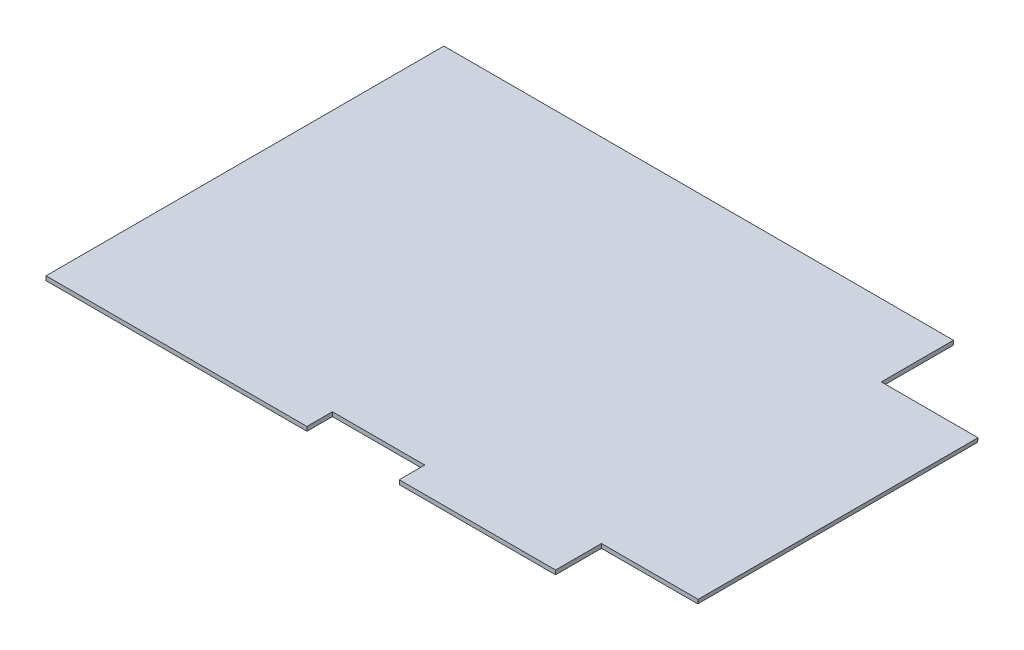
from build123d import *

# Parameters (mm, degrees)
SALIENTE_EXTRUIR1_DEPTH = 91
CROQUIS3_W              = 21.106040847
CROQUIS3_H              = 4.330702007
CROQUIS3_W_2            = 30.122472971
CROQUIS3_H_2            = 14
CORTAR_EXTRUIR2_DEPTH   = 91
CROQUIS4_W              = 22.111814678
CROQUIS4_H              = 2.5
CORTAR_EXTRUIR3_DEPTH   = 10
CORTAR_EXTRUIR4_DEPTH   = 10


with BuildPart() as part:
    # Croquis1 → Saliente-Extruir1 (new body)
    with BuildSketch(Plane.XY):
        Polygon((-53.839851527, -4.678337985), (-53.839851527, -5.641142559), (84.70895538, -5.641142559), (84.804732082, -4.678337985), align=None)
    extrude(amount=SALIENTE_EXTRUIR1_DEPTH)

    # Croquis3 → Cortar-Extruir2 (cut)
    with BuildSketch(Plane(origin=(0, -4.678337985, 0), x_dir=(1, 0, 0), z_dir=(0, 1, 0))):
        with Locations((16.385259295, -87.334648996)):
            Rectangle(CROQUIS3_W, CROQUIS3_H)
        with Locations((77.75415389, -9.5)):
            Rectangle(CROQUIS3_W_2, CROQUIS3_H_2)
        with Locations((77.75415389, -87.5)):
            Rectangle(CROQUIS3_W_2, CROQUIS3_H_2)
    extrude(amount=-CORTAR_EXTRUIR2_DEPTH, mode=Mode.SUBTRACT)

    # Croquis4 → Cortar-Extruir3 (cut)
    with BuildSketch(Plane(origin=(0, -4.678337985, 0), x_dir=(1, 0, 0), z_dir=(0, 1, 0))):
        with Locations((73.748824743, -1.25)):
            Rectangle(CROQUIS4_W, CROQUIS4_H)
    extrude(amount=-CORTAR_EXTRUIR3_DEPTH, mode=Mode.SUBTRACT)

    # Croquis5 → Cortar-Extruir4 (cut)
    with BuildSketch(Plane(origin=(0, -4.678337985, 0), x_dir=(1, 0, 0), z_dir=(0, 1, 0))):
        Polygon((5.832238872, -89.5), (5.832238872, -91), (26.950480476, -91), (26.938279719, -89.5), align=None)
    extrude(amount=-CORTAR_EXTRUIR4_DEPTH, mode=Mode.SUBTRACT)


solid = part.part
